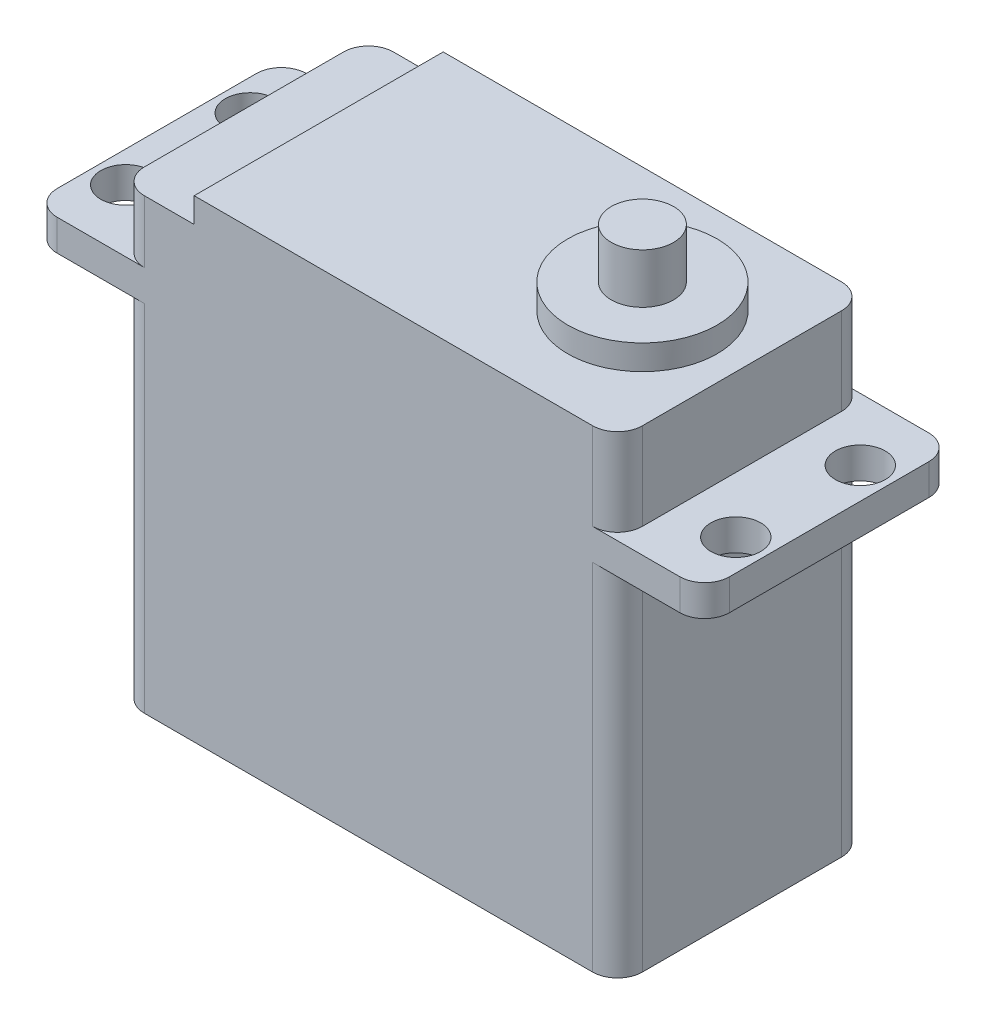
from build123d import *

# Parameters (mm, degrees)
BOSS_EXTRU_1_DEPTH      = 36
ESQUISSE2_W             = 34
ESQUISSE2_H             = 20
BOSS_EXTRU_2_DEPTH      = 2
ESQUISSE3_R             = 6
BOSS_EXTRU_3_DEPTH      = 2
ESQUISSE4_R             = 2.5
BOSS_EXTRU_4_DEPTH      = 4
ESQUISSE5_W             = 20
ESQUISSE5_H             = 2.5
BOSS_EXTRU_5_DEPTH      = 7
ENL_V_MAT_EXTRU_1_REACH = 53.585
ESQUISSE6_R             = 2
CONG_1_R                = 2
ESQUISSE7_W             = 20
ESQUISSE7_H             = 2.5
BOSS_EXTRU_6_DEPTH      = 7
ENL_V_MAT_EXTRU_2_REACH = 59.184
ESQUISSE8_R             = 2
CONG_2_R                = 2


with BuildPart() as part:
    # Esquisse1 → Boss.-Extru.1 (new body)
    with BuildSketch(Plane(origin=(0, 0, 0), x_dir=(1, 0, 0), z_dir=(0, 1, 0))):
        Polygon((0, 0), (0, 10), (40, 10), (40, -10), (0, -10), align=None)
    extrude(amount=BOSS_EXTRU_1_DEPTH)

    # Esquisse2 → Boss.-Extru.2 (add)
    with BuildSketch(Plane(origin=(0, 36, 0), x_dir=(1, 0, 0), z_dir=(0, 1, 0))):
        with Locations((23, 0)):
            Rectangle(ESQUISSE2_W, ESQUISSE2_H)
    extrude(amount=BOSS_EXTRU_2_DEPTH)

    # Esquisse3 → Boss.-Extru.3 (add)
    with BuildSketch(Plane(origin=(0, 38, 0), x_dir=(1, 0, 0), z_dir=(0, 1, 0))):
        with Locations(Location((32, 0, 0), (0, 0, 90))):
            Circle(ESQUISSE3_R)
    extrude(amount=BOSS_EXTRU_3_DEPTH)

    # Esquisse4 → Boss.-Extru.4 (add)
    with BuildSketch(Plane(origin=(0, 40, 0), x_dir=(1, 0, 0), z_dir=(0, 1, 0))):
        with Locations(Location((32, 0, 0), (0, 0, 270))):
            Circle(ESQUISSE4_R)
    extrude(amount=BOSS_EXTRU_4_DEPTH)

    # Esquisse5 → Boss.-Extru.5 (add)
    with BuildSketch(Plane.ZY):
        with Locations((0, 29.75)):
            Rectangle(ESQUISSE5_W, ESQUISSE5_H)
    extrude(amount=BOSS_EXTRU_5_DEPTH)

    # Esquisse6 → Enlèv. mat.-Extru.1 (cut, up to next)
    with BuildSketch(Plane(origin=(0, 31, 0), x_dir=(1, 0, 0), z_dir=(0, 1, 0)), mode=Mode.PRIVATE) as enl_v_mat_extru_1_sk1:
        with Locations(Location((-4.5, 5, 0), (0, 0, 270))):
            Circle(ESQUISSE6_R)
    enl_v_mat_extru_1_tool1 = extrude(enl_v_mat_extru_1_sk1.sketch, amount=-ENL_V_MAT_EXTRU_1_REACH, mode=Mode.PRIVATE) & part.part
    # Esquisse6 → Enlèv. mat.-Extru.1 (cut, up to next)
    with BuildSketch(Plane(origin=(0, 31, 0), x_dir=(1, 0, 0), z_dir=(0, 1, 0)), mode=Mode.PRIVATE) as enl_v_mat_extru_1_sk2:
        with Locations(Location((-4.5, -5, 0), (0, 0, 270))):
            Circle(ESQUISSE6_R)
    enl_v_mat_extru_1_tool2 = extrude(enl_v_mat_extru_1_sk2.sketch, amount=-ENL_V_MAT_EXTRU_1_REACH, mode=Mode.PRIVATE) & part.part
    add(enl_v_mat_extru_1_tool1.solids().sort_by_distance((-4.5, 31, -5))[0], mode=Mode.SUBTRACT)
    add(enl_v_mat_extru_1_tool2.solids().sort_by_distance((-4.5, 31, 5))[0], mode=Mode.SUBTRACT)

    # Congé1
    cong_1_edges = [part.edges().sort_by_distance(p)[0] for p in [
        (0, 14.25, 10),
        (0, 14.25, -10),
        (-7, 29.75, -10),
        (-7, 29.75, 10),
        (0, 33.5, -10),
        (0, 33.5, 10),
    ]]
    fillet(cong_1_edges, radius=CONG_1_R)

    # Esquisse7 → Boss.-Extru.6 (add)
    with BuildSketch(Plane(origin=(40, 0, 0), x_dir=(0, 0, -1), z_dir=(1, 0, 0))):
        with Locations((0, 29.75)):
            Rectangle(ESQUISSE7_W, ESQUISSE7_H)
    extrude(amount=BOSS_EXTRU_6_DEPTH)

    # Esquisse8 → Enlèv. mat.-Extru.2 (cut, up to next)
    with BuildSketch(Plane(origin=(0, 31, 0), x_dir=(1, 0, 0), z_dir=(0, 1, 0)), mode=Mode.PRIVATE) as enl_v_mat_extru_2_sk1:
        with Locations(Location((44.5, 5, 0), (0, 0, 270))):
            Circle(ESQUISSE8_R)
    enl_v_mat_extru_2_tool1 = extrude(enl_v_mat_extru_2_sk1.sketch, amount=-ENL_V_MAT_EXTRU_2_REACH, mode=Mode.PRIVATE) & part.part
    # Esquisse8 → Enlèv. mat.-Extru.2 (cut, up to next)
    with BuildSketch(Plane(origin=(0, 31, 0), x_dir=(1, 0, 0), z_dir=(0, 1, 0)), mode=Mode.PRIVATE) as enl_v_mat_extru_2_sk2:
        with Locations(Location((44.5, -5, 0), (0, 0, 270))):
            Circle(ESQUISSE8_R)
    enl_v_mat_extru_2_tool2 = extrude(enl_v_mat_extru_2_sk2.sketch, amount=-ENL_V_MAT_EXTRU_2_REACH, mode=Mode.PRIVATE) & part.part
    add(enl_v_mat_extru_2_tool1.solids().sort_by_distance((44.5, 31, -5))[0], mode=Mode.SUBTRACT)
    add(enl_v_mat_extru_2_tool2.solids().sort_by_distance((44.5, 31, 5))[0], mode=Mode.SUBTRACT)

    # Congé2
    cong_2_edges = [part.edges().sort_by_distance(p)[0] for p in [
        (40, 14.25, -10),
        (40, 14.25, 10),
        (47, 29.75, 10),
        (47, 29.75, -10),
        (40, 34.5, -10),
        (40, 34.5, 10),
    ]]
    fillet(cong_2_edges, radius=CONG_2_R)


solid = part.part
